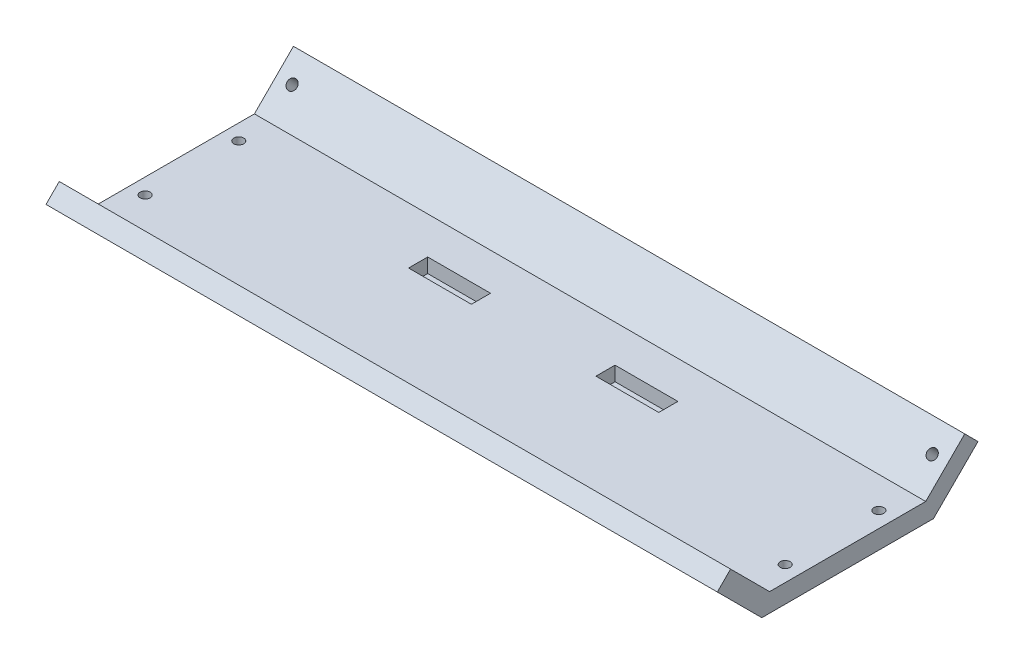
from build123d import *

# Parameters (mm, degrees)
MAIN_DEPTH                      = 107.5
F_4_0MM_DOWEL_HOLE2_D           = 3.2
F_4_0MM_DOWEL_HOLE2_ON_FACE_2_D = 3.2
F_4_0MM_DOWEL_HOLE2_ON_FACE_3_D = 3.2
F_4_0MM_DOWEL_HOLE2_ON_FACE_4_D = 3.2
SKETCH6_W                       = 20.125
SKETCH6_H                       = 6.125
SHELF_CUT_DEPTH                 = 116.995465651
SKETCH7_W                       = 20.125
SKETCH7_H                       = 6.125
BOSS_EXTRUDE2_DEPTH             = 1.4


with BuildPart() as part:
    # Sketch2 → Main (new, symmetric)
    with BuildSketch(Plane(origin=(0, 0, 0), x_dir=(0, 0, -1), z_dir=(1, 0, 0))):
        Polygon((-25, 0), (25, 0), (37.5, 12.5), (41.742640687, 8.257359313), (27.485281374, -6), (-27.485281374, -6), (-41.742640687, 8.257359313), (-37.5, 12.5), align=None)
    extrude(amount=MAIN_DEPTH, both=True)

    # Ø4.0mm Dowel Hole2 (through all)
    with Locations(Plane(origin=(-102.5, 7.071067812, -32.071067812), x_dir=(0, 0.707106781187, -0.707106781187), z_dir=(0, 0.707106781187, 0.707106781187))):
        with Locations((0, 0)):
            Hole(F_4_0MM_DOWEL_HOLE2_D / 2)

    # Ø4.0mm Dowel Hole2 on face 2 (through all)
    with Locations(Plane(origin=(-102.5, 0, -15), x_dir=(0, 0, 1), z_dir=(0, 1, 0))):
        with Locations((0, 0), (30, 0), (30, 205), (0, 205)):
            Hole(F_4_0MM_DOWEL_HOLE2_ON_FACE_2_D / 2)

    # Ø4.0mm Dowel Hole2 on face 3 (through all)
    with Locations(Plane(origin=(-102.5, 7.071067812, 32.071067812), x_dir=(0, -0.707106781187, -0.707106781187), z_dir=(0, 0.707106781187, -0.707106781187))):
        with Locations((0, 0), (0, -205)):
            Hole(F_4_0MM_DOWEL_HOLE2_ON_FACE_3_D / 2)

    # Ø4.0mm Dowel Hole2 on face 4 (through all)
    with Locations(Plane(origin=(102.5, 7.071067812, -32.071067812), x_dir=(0, 0.707106781187, -0.707106781187), z_dir=(0, 0.707106781187, 0.707106781187))):
        with Locations((0, 0)):
            Hole(F_4_0MM_DOWEL_HOLE2_ON_FACE_4_D / 2)

    # Sketch6 → Shelf cut (cut, through all)
    with BuildSketch(Plane(origin=(0, 0, 0), x_dir=(1, 0, 0), z_dir=(0, 1, 0))):
        with Locations((30, 10)):
            Rectangle(SKETCH6_W, SKETCH6_H)
        with Locations((-30, 10)):
            Rectangle(SKETCH6_W, SKETCH6_H)
    extrude(amount=-SHELF_CUT_DEPTH, mode=Mode.SUBTRACT)

    # Sketch7 → Boss-Extrude2 (add)
    with BuildSketch(Plane.XZ.offset(6)):
        with Locations((30, -10)):
            Rectangle(SKETCH7_W, SKETCH7_H)
        with Locations((-30, -10)):
            Rectangle(SKETCH7_W, SKETCH7_H)
    extrude(amount=-BOSS_EXTRUDE2_DEPTH)


solid = part.part
